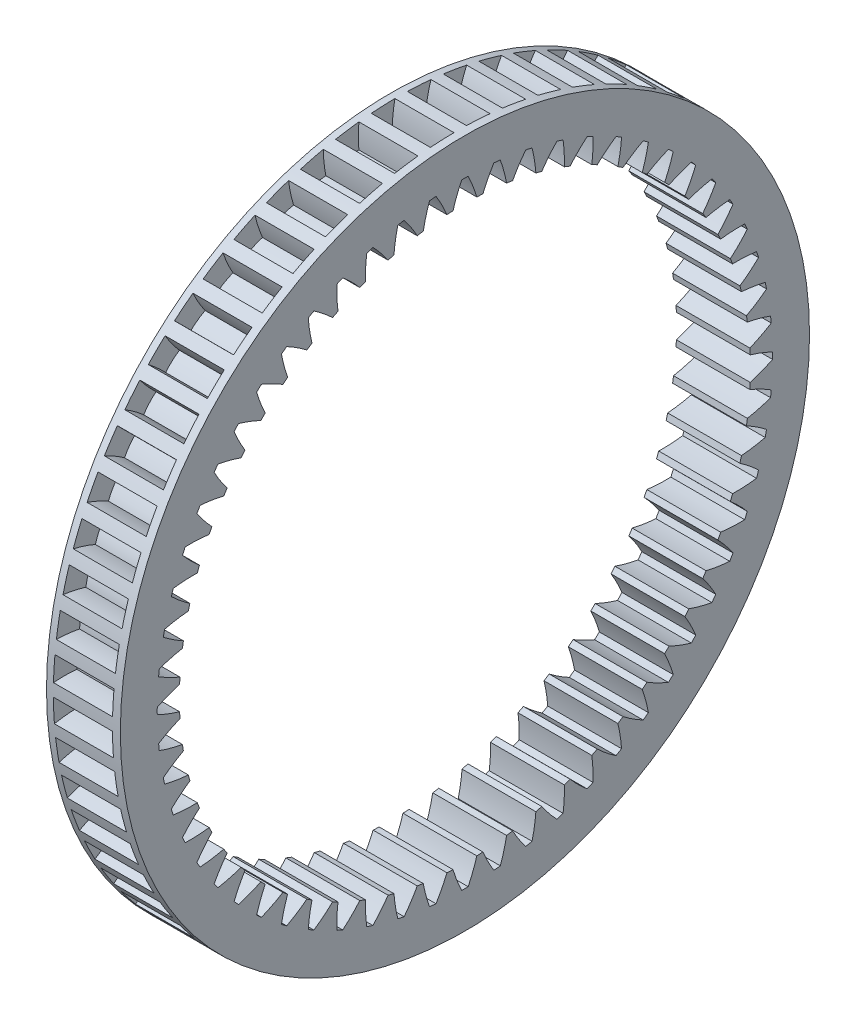
from build123d import *

# Parameters (mm, degrees)
SKETCH1_W           = 1.599635858
SKETCH1_H           = 70
BOSS_EXTRUDE1_DEPTH = 12
SKETCH3_R           = 70
BOSS_EXTRUDE2_DEPTH = 1.400364142
CUT_EXTRUDE1_DEPTH  = 138.402329374


with BuildPart() as part:
    # Sketch1 → Revolve1 (revolve)
    with BuildSketch(Plane(origin=(0, 0, -17.780283278), x_dir=(-1, 0, 0), z_dir=(0, 0, -1)), mode=Mode.PRIVATE) as revolve1_sk:
        with Locations((4.200182071, 69.637574442)):
            Rectangle(SKETCH1_W, SKETCH1_H)
    revolve(revolve1_sk.sketch.rotate(Axis((-3.400364142, 34.637574442, -17.780283278), (-1, 0, 0)), 270), axis=Axis((-3.400364142, 34.637574442, -17.780283278), (-1, 0, 0)))

    # Sketch2 → Boss-Extrude1 (add)
    with BuildSketch(Plane.ZY.offset(5)):
        with BuildLine():
            ThreePointArc((-82.867556768, 39.566803131), (-83.007438278, 37.673059904), (-82.867556768, 35.779316676))
            ThreePointArc((-82.867556768, 35.779316676), (-85.335284127, 35.638618783), (-87.777533963, 35.257974656))
            ThreePointArc((-87.777533963, 35.257974656), (-87.777284922, 33.989684921), (-87.754057451, 32.721607874))
            ThreePointArc((-87.754057451, 32.721607874), (-85.389808184, 32.618534204), (-83.026246573, 32.736327625))
            ThreePointArc((-83.026246573, 32.736327625), (-82.967411728, 30.838336921), (-82.630346435, 28.969589416))
            ThreePointArc((-82.630346435, 28.969589416), (-85.06984839, 28.571714532), (-87.458931181, 27.937870991))
            ThreePointArc((-87.458931181, 27.937870991), (-87.326111127, 26.676555113), (-87.170460754, 25.417852656))
            ThreePointArc((-87.170460754, 25.417852656), (-84.808388959, 25.562474977), (-82.470087952, 25.926682576))
            ThreePointArc((-82.470087952, 25.926682576), (-82.213181358, 24.04523918), (-81.682625239, 22.221961787))
            ThreePointArc((-81.682625239, 22.221961787), (-84.067174097, 21.571269112), (-86.376914551, 20.69117068))
            ThreePointArc((-86.376914551, 20.69117068), (-86.112978689, 19.450647898), (-85.826610751, 18.215110639))
            ThreePointArc((-85.826610751, 18.215110639), (-83.492595782, 18.605844439), (-81.205174293, 19.212475881))
            ThreePointArc((-81.205174293, 19.212475881), (-80.753010674, 17.368193281), (-80.034776612, 15.610362208))
            ThreePointArc((-80.034776612, 15.610362208), (-82.338246757, 14.713980868), (-84.543338875, 13.597270086))
            ThreePointArc((-84.543338875, 13.597270086), (-84.15117894, 12.391131828), (-83.737230945, 11.192296573))
            ThreePointArc((-83.737230945, 11.192296573), (-81.456844758, 11.824860889), (-79.245364255, 12.667269795))
            ThreePointArc((-79.245364255, 12.667269795), (-78.60289761, 10.880354335), (-77.704854729, 9.207228747))
            ThreePointArc((-77.704854729, 9.207228747), (-79.902008859, 8.074979684), (-81.97829319, 6.733891471))
            ThreePointArc((-81.97829319, 6.733891471), (-81.46220577, 5.575352439), (-80.925213018, 4.426353876))
            ThreePointArc((-80.925213018, 4.426353876), (-78.723440001, 5.293818204), (-76.612129928, 6.362774963))
            ThreePointArc((-76.612129928, 6.362774963), (-75.786399255, 4.652804465), (-74.7183867, 3.082715476))
            ThreePointArc((-74.7183867, 3.082715476), (-76.785152336, 1.727003847), (-78.709880674, 0.176231445))
            ThreePointArc((-78.709880674, 0.176231445), (-78.07552013, -0.922015164), (-77.421366027, -2.008588365))
            ThreePointArc((-77.421366027, -2.008588365), (-75.322329266, -0.915728148), (-73.334321578, 0.368064751))
            ThreePointArc((-73.334321578, 0.368064751), (-72.334373755, -1.246225991), (-71.108092896, -2.696076157))
            ThreePointArc((-71.108092896, -2.696076157), (-73.02182612, -4.260396892), (-74.773910738, -6.003862896))
            ThreePointArc((-74.773910738, -6.003862896), (-74.028227258, -7.029784462), (-73.264078853, -8.042027578))
            ThreePointArc((-73.264078853, -8.042027578), (-71.290775833, -6.735745077), (-69.447851558, -5.251181541))
            ThreePointArc((-69.447851558, -5.251181541), (-68.284642224, -6.752106021), (-66.91352845, -8.065832502))
            ThreePointArc((-66.91352845, -8.065832502), (-68.653262001, -9.821623317), (-70.213506694, -11.738681144))
            ThreePointArc((-70.213506694, -11.738681144), (-69.364670141, -12.681037456), (-68.498899603, -13.607860141))
            ThreePointArc((-68.498899603, -13.607860141), (-66.672950247, -12.10246726), (-64.995300849, -10.433398275))
            ThreePointArc((-64.995300849, -10.433398275), (-63.681574368, -11.804512049), (-62.180649888, -12.967721383))
            ThreePointArc((-62.180649888, -12.967721383), (-63.727322881, -14.895745468), (-65.078633281, -16.965391432))
            ThreePointArc((-65.078633281, -16.965391432), (-64.135943687, -17.813857837), (-63.178036579, -18.645105626))
            ThreePointArc((-63.178036579, -18.645105626), (-61.519446369, -16.957095764), (-60.025452526, -15.121808))
            ThreePointArc((-60.025452526, -15.121808), (-58.575602361, -16.34808886), (-56.961311618, -17.348036682))
            ThreePointArc((-56.961311618, -17.348036682), (-58.297978379, -19.4271702), (-59.425549248, -21.626728826))
            ThreePointArc((-59.425549248, -21.626728826), (-58.399334916, -22.372009349), (-57.359786271, -23.098574918))
            ThreePointArc((-57.359786271, -23.098574918), (-55.886727068, -21.246442265), (-54.592757289, -19.265043519))
            ThreePointArc((-54.592757289, -19.265043519), (-53.022668301, -20.333056074), (-51.312697802, -21.158786747))
            ThreePointArc((-51.312697802, -21.158786747), (-52.424713532, -23.366250276), (-53.316190966, -25.67162274))
            ThreePointArc((-53.316190966, -25.67162274), (-52.217695316, -26.305551931), (-51.107894644, -26.919474875))
            ThreePointArc((-51.107894644, -26.919474875), (-49.836505594, -24.923511784), (-48.756736883, -22.817710675))
            ThreePointArc((-48.756736883, -22.817710675), (-47.083611295, -23.715753557), (-45.296695836, -24.358220202))
            ThreePointArc((-45.296695836, -24.358220202), (-46.171877057, -26.66982831), (-46.817493844, -29.055756469))
            ThreePointArc((-46.817493844, -29.055756469), (-45.658752223, -29.571388868), (-44.490858734, -30.065942919))
            ThreePointArc((-44.490858734, -30.065942919), (-43.43506944, -27.948017579), (-42.581331969, -25.740885705))
            ThreePointArc((-42.581331969, -25.740885705), (-40.823500896, -26.459119766), (-38.979218296, -26.911283385))
            ThreePointArc((-38.979218296, -26.911283385), (-39.607976339, -29.301709611), (-40.000658965, -31.742052736))
            ThreePointArc((-40.000658965, -31.742052736), (-38.794366791, -32.133738965), (-37.581176169, -32.503505686))
            ThreePointArc((-37.581176169, -32.503505686), (-36.752554081, -30.28682253), (-36.134201576, -28.00254169))
            ThreePointArc((-36.134201576, -28.00254169), (-34.310924183, -28.533097809), (-32.429480787, -28.790004403))
            ThreePointArc((-32.429480787, -28.790004403), (-32.804926848, -31.233058735), (-32.940373001, -33.701079917))
            ThreePointArc((-32.940373001, -33.701079917), (-31.699746662, -33.964528581), (-30.454550878, -34.205456729))
            ThreePointArc((-30.454550878, -34.205456729), (-29.862174552, -31.914302202), (-29.485981813, -29.577899454))
            ThreePointArc((-29.485981813, -29.577899454), (-27.617234308, -29.914964748), (-25.719243605, -29.973799593))
            ThreePointArc((-25.719243605, -29.973799593), (-25.837264218, -32.442715418), (-25.713989921, -34.9113745))
            ThreePointArc((-25.713989921, -34.9113745), (-24.452621979, -35.043699199), (-23.189063659, -35.153149117))
            ThreePointArc((-23.189063659, -35.153149117), (-22.839423295, -32.812625587), (-22.709511967, -30.449699049))
            ThreePointArc((-22.709511967, -30.449699049), (-20.81576874, -30.589580558), (-18.922025512, -30.449699049))
            ThreePointArc((-18.922025512, -30.449699049), (-18.781327619, -32.917426408), (-18.400683492, -35.359676244))
            ThreePointArc((-18.400683492, -35.359676244), (-17.132393757, -35.359427202), (-15.86431671, -35.336199732))
            ThreePointArc((-15.86431671, -35.336199732), (-15.76124304, -32.971950465), (-15.879036461, -30.608388854))
            ThreePointArc((-15.879036461, -30.608388854), (-13.981045757, -30.549554009), (-12.112298252, -30.212488715))
            ThreePointArc((-12.112298252, -30.212488715), (-11.714423368, -32.651990671), (-11.080579827, -35.041073462))
            ThreePointArc((-11.080579827, -35.041073462), (-9.819263949, -34.908253408), (-8.560561492, -34.752603035))
            ThreePointArc((-8.560561492, -34.752603035), (-8.705183813, -32.39053124), (-9.069391412, -30.052230232))
            ThreePointArc((-9.069391412, -30.052230232), (-7.187948016, -29.795323639), (-5.364670623, -29.26476752))
            ThreePointArc((-5.364670623, -29.26476752), (-4.713977948, -31.649316378), (-3.833879516, -33.959056832))
            ThreePointArc((-3.833879516, -33.959056832), (-2.593356734, -33.695120969), (-1.357819475, -33.408753032))
            ThreePointArc((-1.357819475, -33.408753032), (-1.748553275, -31.074738063), (-2.355184717, -28.787316573))
            ThreePointArc((-2.355184717, -28.787316573), (-0.510902117, -28.335152954), (1.246928956, -27.616918893))
            ThreePointArc((1.246928956, -27.616918893), (2.143310296, -29.920389038), (3.260021078, -32.125481155))
            ThreePointArc((3.260021078, -32.125481155), (4.466159336, -31.733321221), (5.664994591, -31.319373226))
            ThreePointArc((5.664994591, -31.319373226), (5.032430275, -29.038987039), (4.190021369, -26.827506536))
            ThreePointArc((4.190021369, -26.827506536), (5.976936829, -26.18503989), (7.650062417, -25.286997009))
            ThreePointArc((7.650062417, -25.286997009), (8.78231148, -27.48415114), (10.123399693, -29.56043547))
            ThreePointArc((10.123399693, -29.56043547), (11.281938725, -29.04434805), (12.430937288, -28.507355299))
            ThreePointArc((12.430937288, -28.507355299), (11.563472961, -26.305582282), (10.494516201, -24.194272209))
            ThreePointArc((10.494516201, -24.194272209), (12.204486699, -23.368541536), (13.774575688, -22.300528981))
            ThreePointArc((13.774575688, -22.300528981), (15.130287317, -24.367294617), (16.681059719, -26.292022954))
            ThreePointArc((16.681059719, -26.292022954), (17.779306328, -25.657662411), (18.865879529, -25.003508308))
            ThreePointArc((18.865879529, -25.003508308), (17.773019313, -22.904471547), (16.489226413, -20.916463859))
            ThreePointArc((16.489226413, -20.916463859), (18.103517155, -19.916516036), (19.553367321, -18.690235177))
            ThreePointArc((19.553367321, -18.690235177), (21.117688056, -20.603968401), (22.86115406, -22.356053019))
            ThreePointArc((22.86115406, -22.356053019), (23.887075626, -21.610369539), (24.899318743, -20.846221133))
            ThreePointArc((24.899318743, -20.846221133), (23.593036241, -18.872918114), (22.108472705, -17.029993839))
            ThreePointArc((22.108472705, -17.029993839), (23.609397185, -15.866784505), (24.923123666, -14.495670731))
            ThreePointArc((24.923123666, -14.495670731), (26.678914481, -16.235404281), (28.595972308, -17.795648975))
            ThreePointArc((28.595972308, -17.795648975), (29.53832862, -16.946812422), (30.465151305, -16.081041884))
            ThreePointArc((30.465151305, -16.081041884), (28.959758424, -14.255092527), (27.290689439, -12.57744313))
            ThreePointArc((27.290689439, -12.57744313), (28.661803213, -11.263716648), (29.825012547, -9.762792169))
            ThreePointArc((29.825012547, -9.762792169), (31.753036632, -11.309465161), (33.822682596, -12.660775562))
            ThreePointArc((33.822682596, -12.660775562), (34.671149001, -11.718085967), (35.50239679, -10.76017886))
            ThreePointArc((35.50239679, -10.76017886), (33.814386928, -9.10158865), (31.979099164, -7.607594807))
            ThreePointArc((31.979099164, -7.607594807), (33.205380024, -6.157744641), (34.205327846, -4.543453899))
            ThreePointArc((34.205327846, -4.543453899), (36.284461364, -5.88012066), (38.48401999, -7.007691529))
            ThreePointArc((38.48401999, -7.007691529), (39.229300513, -5.981477197), (39.955866082, -4.941928551))
            ThreePointArc((39.955866082, -4.941928551), (38.103733429, -3.468869349), (36.122334683, -2.17489957))
            ThreePointArc((36.122334683, -2.17489957), (37.190347238, -0.604810581), (38.016077911, 1.105159917))
            ThreePointArc((38.016077911, 1.105159917), (40.22354144, -0.006855813), (42.528913904, -0.898333247))
            ThreePointArc((42.528913904, -0.898333247), (43.162843095, 0.200162403), (43.776766039, 1.309963075))
            ThreePointArc((43.776766039, 1.309963075), (41.780802948, 2.581352125), (39.675001839, 3.661120836))
            ThreePointArc((39.675001839, 3.661120836), (40.573044721, 5.334246424), (41.215511366, 7.121161883))
            ThreePointArc((41.215511366, 7.121161883), (43.527119474, 6.245980663), (45.913047633, 5.600363876))
            ThreePointArc((45.913047633, 5.600363876), (46.428680032, 6.759105496), (46.923234083, 7.926998985))
            ThreePointArc((46.923234083, 7.926998985), (44.805308743, 8.982788279), (42.598176869, 9.83652575))
            ThreePointArc((42.598176869, 9.83652575), (43.31641093, 11.594356823), (43.76857455, 13.438639424))
            ThreePointArc((43.76857455, 13.438639424), (46.159000775, 12.809881381), (48.5993439, 12.417198754))
            ThreePointArc((48.5993439, 12.417198754), (48.991030129, 13.623490928), (49.36079685, 14.83668155))
            ThreePointArc((49.36079685, 14.83668155), (47.144113694, 15.665303638), (44.859832854, 16.283656143))
            ThreePointArc((44.859832854, 16.283656143), (45.390388973, 18.106933537), (45.647295567, 19.988376932))
            ThreePointArc((45.647295567, 19.988376932), (48.090349899, 19.612930871), (50.558371081, 19.477484718))
            ThreePointArc((50.558371081, 19.477484718), (50.821819745, 20.718111058), (51.062747893, 21.963306841))
            ThreePointArc((51.062747893, 21.963306841), (48.771593366, 22.555683167), (46.435190618, 22.931875906))
            ThreePointArc((46.435190618, 22.931875906), (46.772255912, 24.800623411), (46.831090757, 26.698614115))
            ThreePointArc((46.831090757, 26.698614115), (49.300006582, 26.580593501), (51.768665664, 26.703867798))
            ThreePointArc((51.768665664, 26.703867798), (51.900990364, 27.96523574), (52.010440281, 29.22879406))
            ThreePointArc((52.010440281, 29.22879406), (49.669916751, 29.578434425), (47.306990213, 29.708345752))
            ThreePointArc((47.306990213, 29.708345752), (47.446871722, 31.60208898), (47.306990213, 33.495832207))
            ThreePointArc((47.306990213, 33.495832207), (49.774717572, 33.636530101), (52.216967408, 34.017174228))
            ThreePointArc((52.216967408, 34.017174228), (52.216718367, 35.285463962), (52.193490896, 36.553541009))
            ThreePointArc((52.193490896, 36.553541009), (49.829241629, 36.656614679), (47.465680018, 36.538821259))
            ThreePointArc((47.465680018, 36.538821259), (47.406845173, 38.436811962), (47.069779879, 40.305559467))
            ThreePointArc((47.069779879, 40.305559467), (49.509281835, 40.703434351), (51.898364626, 41.337277892))
            ThreePointArc((51.898364626, 41.337277892), (51.765544572, 42.598593771), (51.609894199, 43.857296227))
            ThreePointArc((51.609894199, 43.857296227), (49.247822404, 43.712673906), (46.909521396, 43.348466307))
            ThreePointArc((46.909521396, 43.348466307), (46.652614803, 45.229909703), (46.122058684, 47.053187097))
            ThreePointArc((46.122058684, 47.053187097), (48.506607542, 47.703879771), (50.816347996, 48.583978203))
            ThreePointArc((50.816347996, 48.583978203), (50.552412134, 49.824500986), (50.266044196, 51.060038244))
            ThreePointArc((50.266044196, 51.060038244), (47.932029227, 50.669304444), (45.644607737, 50.062673002))
            ThreePointArc((45.644607737, 50.062673002), (45.192444118, 51.906955603), (44.474210057, 53.664786676))
            ThreePointArc((44.474210057, 53.664786676), (46.777680202, 54.561168015), (48.982772319, 55.677878797))
            ThreePointArc((48.982772319, 55.677878797), (48.590612385, 56.884017055), (48.17666439, 58.082852311))
            ThreePointArc((48.17666439, 58.082852311), (45.896278203, 57.450287994), (43.6847977, 56.607879089))
            ThreePointArc((43.6847977, 56.607879089), (43.042331054, 58.394794548), (42.144288173, 60.067920136))
            ThreePointArc((42.144288173, 60.067920136), (44.341442304, 61.200169199), (46.417726634, 62.541257413))
            ThreePointArc((46.417726634, 62.541257413), (45.901639214, 63.699796444), (45.364646463, 64.848795007))
            ThreePointArc((45.364646463, 64.848795007), (43.162873446, 63.98133068), (41.051563373, 62.91237392))
            ThreePointArc((41.051563373, 62.91237392), (40.2258327, 64.622344419), (39.157820145, 66.192433407))
            ThreePointArc((39.157820145, 66.192433407), (41.224585781, 67.548145037), (43.149314118, 69.098917439))
            ThreePointArc((43.149314118, 69.098917439), (42.514953575, 70.197164047), (41.860799472, 71.283737249))
            ThreePointArc((41.860799472, 71.283737249), (39.761762711, 70.190877032), (37.773755023, 68.907084132))
            ThreePointArc((37.773755023, 68.907084132), (36.7738072, 70.521374875), (35.547526341, 71.97122504))
            ThreePointArc((35.547526341, 71.97122504), (37.461259565, 73.535545775), (39.213344183, 75.279011779))
            ThreePointArc((39.213344183, 75.279011779), (38.467660703, 76.304933345), (37.703512297, 77.317176462))
            ThreePointArc((37.703512297, 77.317176462), (35.730209278, 76.010893961), (33.887285003, 74.526330424))
            ThreePointArc((33.887285003, 74.526330424), (32.724075669, 76.027254904), (31.352961895, 77.340981385))
            ThreePointArc((31.352961895, 77.340981385), (33.092695446, 79.0967722), (34.652940139, 81.013830028))
            ThreePointArc((34.652940139, 81.013830028), (33.804103586, 81.95618634), (32.938333048, 82.883009024))
            ThreePointArc((32.938333048, 82.883009024), (31.112383692, 81.377616143), (29.434734294, 79.708547158))
            ThreePointArc((29.434734294, 79.708547158), (28.121007813, 81.079660933), (26.620083333, 82.242870267))
            ThreePointArc((26.620083333, 82.242870267), (28.166756325, 84.170894351), (29.518066726, 86.240540315))
            ThreePointArc((29.518066726, 86.240540315), (28.575377131, 87.08900672), (27.617470024, 87.920254509))
            ThreePointArc((27.617470024, 87.920254509), (25.958879814, 86.232244647), (24.464885971, 84.396956884))
            ThreePointArc((24.464885971, 84.396956884), (23.015035805, 85.623237743), (21.400745063, 86.623185565))
            ThreePointArc((21.400745063, 86.623185565), (22.737411824, 88.702319083), (23.864982693, 90.90187771))
            ThreePointArc((23.864982693, 90.90187771), (22.838768361, 91.647158232), (21.799219715, 92.373723801))
            ThreePointArc((21.799219715, 92.373723801), (20.326160513, 90.521591148), (19.032190734, 88.540192402))
            ThreePointArc((19.032190734, 88.540192402), (17.462101745, 89.608204957), (15.752131247, 90.43393563))
            ThreePointArc((15.752131247, 90.43393563), (16.864146977, 92.641399159), (17.755624411, 94.946771624))
            ThreePointArc((17.755624411, 94.946771624), (16.657128761, 95.580700814), (15.547328089, 96.194623758))
            ThreePointArc((15.547328089, 96.194623758), (14.275939039, 94.198660667), (13.196170328, 92.092859559))
            ThreePointArc((13.196170328, 92.092859559), (11.52304474, 92.99090244), (9.736129281, 93.633369085))
            ThreePointArc((9.736129281, 93.633369085), (10.611310501, 95.944977194), (11.256927288, 98.330905353))
            ThreePointArc((11.256927288, 98.330905353), (10.098185668, 98.846537751), (8.930292179, 99.341091802))
            ThreePointArc((8.930292179, 99.341091802), (7.874502885, 97.223166462), (7.020765414, 95.016034588))
            ThreePointArc((7.020765414, 95.016034588), (5.262934341, 95.73426865), (3.41865174, 96.186432269))
            ThreePointArc((3.41865174, 96.186432269), (4.047409783, 98.576858494), (4.44009241, 101.01720162))
            ThreePointArc((4.44009241, 101.01720162), (3.233800236, 101.408887849), (2.020609614, 101.778654569))
            ThreePointArc((2.020609614, 101.778654569), (1.191987526, 99.561971413), (0.573635021, 97.277690573))
            ThreePointArc((0.573635021, 97.277690573), (-1.249642373, 97.808246693), (-3.131085768, 98.065153286))
            ThreePointArc((-3.131085768, 98.065153286), (-2.755639707, 100.508207618), (-2.620193554, 102.9762288))
            ThreePointArc((-2.620193554, 102.9762288), (-3.860819893, 103.239677464), (-5.106015677, 103.480605613))
            ThreePointArc((-5.106015677, 103.480605613), (-5.698392003, 101.189451085), (-6.074584742, 98.853048337))
            ThreePointArc((-6.074584742, 98.853048337), (-7.943332247, 99.190113631), (-9.84132295, 99.248948476))
            ThreePointArc((-9.84132295, 99.248948476), (-9.723302337, 101.717864301), (-9.846576634, 104.186523383))
            ThreePointArc((-9.846576634, 104.186523383), (-11.107944576, 104.318848083), (-12.371502896, 104.428298))
            ThreePointArc((-12.371502896, 104.428298), (-12.721143261, 102.08777447), (-12.851054588, 99.724847932))
            ThreePointArc((-12.851054588, 99.724847932), (-14.744797816, 99.864729442), (-16.638541043, 99.724847932))
            ThreePointArc((-16.638541043, 99.724847932), (-16.779238937, 102.192575291), (-17.159883064, 104.634825127))
            ThreePointArc((-17.159883064, 104.634825127), (-18.428172798, 104.634576086), (-19.696249845, 104.611348615))
            ThreePointArc((-19.696249845, 104.611348615), (-19.799323515, 102.247099348), (-19.681530094, 99.883537738))
            ThreePointArc((-19.681530094, 99.883537738), (-21.579520798, 99.824702892), (-23.448268303, 99.487637599))
            ThreePointArc((-23.448268303, 99.487637599), (-23.846143187, 101.927139554), (-24.479986728, 104.316222345))
            ThreePointArc((-24.479986728, 104.316222345), (-25.741302607, 104.183402291), (-27.000005063, 104.027751918))
            ThreePointArc((-27.000005063, 104.027751918), (-26.855382742, 101.665680124), (-26.491175143, 99.327379116))
            ThreePointArc((-26.491175143, 99.327379116), (-28.372618539, 99.070472522), (-30.195895932, 98.539916403))
            ThreePointArc((-30.195895932, 98.539916403), (-30.846588607, 100.924465261), (-31.726687039, 103.234205715))
            ThreePointArc((-31.726687039, 103.234205715), (-32.967209821, 102.970269853), (-34.20274708, 102.683901915))
            ThreePointArc((-34.20274708, 102.683901915), (-33.81201328, 100.349886946), (-33.205381838, 98.062465457))
            ThreePointArc((-33.205381838, 98.062465457), (-35.049664438, 97.610301838), (-36.807495512, 96.892067776))
            ThreePointArc((-36.807495512, 96.892067776), (-37.703876851, 99.195537921), (-38.820587633, 101.400630039))
            ThreePointArc((-38.820587633, 101.400630039), (-40.026725891, 101.008470104), (-41.225561147, 100.594522109))
            ThreePointArc((-41.225561147, 100.594522109), (-40.59299683, 98.314135922), (-39.750587925, 96.102655419))
            ThreePointArc((-39.750587925, 96.102655419), (-41.537503384, 95.460188774), (-43.210628972, 94.562145893))
            ThreePointArc((-43.210628972, 94.562145893), (-44.342878035, 96.759300023), (-45.683966249, 98.835584354))
            ThreePointArc((-45.683966249, 98.835584354), (-46.84250528, 98.319496934), (-47.991503843, 97.782504182))
            ThreePointArc((-47.991503843, 97.782504182), (-47.124039516, 95.580731165), (-46.055082756, 93.469421092))
            ThreePointArc((-46.055082756, 93.469421092), (-47.765053255, 92.643690419), (-49.335142243, 91.575677864))
            ThreePointArc((-49.335142243, 91.575677864), (-50.690853873, 93.6424435), (-52.241626275, 95.567171838))
            ThreePointArc((-52.241626275, 95.567171838), (-53.339872883, 94.932811294), (-54.426446085, 94.278657191))
            ThreePointArc((-54.426446085, 94.278657191), (-53.333585868, 92.17962043), (-52.049792968, 90.191612742))
            ThreePointArc((-52.049792968, 90.191612742), (-53.664083711, 89.191664919), (-55.113933876, 87.96538406))
            ThreePointArc((-55.113933876, 87.96538406), (-56.678254611, 89.879117284), (-58.421720615, 91.631201902))
            ThreePointArc((-58.421720615, 91.631201902), (-59.447642181, 90.885518422), (-60.459885298, 90.121370017))
            ThreePointArc((-60.459885298, 90.121370017), (-59.153602797, 88.148066997), (-57.66903926, 86.305142722))
            ThreePointArc((-57.66903926, 86.305142722), (-59.16996374, 85.141933388), (-60.483690221, 83.770819614))
            ThreePointArc((-60.483690221, 83.770819614), (-62.239481036, 85.510553165), (-64.156538864, 87.070797858))
            ThreePointArc((-64.156538864, 87.070797858), (-65.098895176, 86.221961305), (-66.02571786, 85.356190767))
            ThreePointArc((-66.02571786, 85.356190767), (-64.520324979, 83.530241411), (-62.851255994, 81.852592013))
            ThreePointArc((-62.851255994, 81.852592013), (-64.222369769, 80.538865532), (-65.385579103, 79.037941052))
            ThreePointArc((-65.385579103, 79.037941052), (-67.313603187, 80.584614045), (-69.383249151, 81.935924445))
            ThreePointArc((-69.383249151, 81.935924445), (-70.231715556, 80.993234851), (-71.062963345, 80.035327743))
            ThreePointArc((-71.062963345, 80.035327743), (-69.374953483, 78.376737533), (-67.53966572, 76.88274369))
            ThreePointArc((-67.53966572, 76.88274369), (-68.765946579, 75.432893525), (-69.765894401, 73.818602782))
            ThreePointArc((-69.765894401, 73.818602782), (-71.845027919, 75.155269543), (-74.044586546, 76.282840412))
            ThreePointArc((-74.044586546, 76.282840412), (-74.789867068, 75.25662608), (-75.516432637, 74.217077435))
            ThreePointArc((-75.516432637, 74.217077435), (-73.664299984, 72.744018232), (-71.682901238, 71.450048453))
            ThreePointArc((-71.682901238, 71.450048453), (-72.750913793, 69.879959465), (-73.576644466, 68.169988966))
            ThreePointArc((-73.576644466, 68.169988966), (-75.784107995, 69.282004696), (-78.08948046, 70.17348213))
            ThreePointArc((-78.08948046, 70.17348213), (-78.72340965, 69.07498648), (-79.337332594, 67.965185808))
            ThreePointArc((-79.337332594, 67.965185808), (-77.341369503, 66.693796758), (-75.235568395, 65.614028047))
            ThreePointArc((-75.235568395, 65.614028047), (-76.133611276, 63.940902459), (-76.776077921, 62.153987))
            ThreePointArc((-76.776077921, 62.153987), (-79.08768603, 63.029168221), (-81.473614189, 63.674785008))
            ThreePointArc((-81.473614189, 63.674785008), (-81.989246587, 62.516043387), (-82.483800638, 61.348149898))
            ThreePointArc((-82.483800638, 61.348149898), (-80.365875298, 60.292360605), (-78.158743424, 59.438623133))
            ThreePointArc((-78.158743424, 59.438623133), (-78.876977486, 57.68079206), (-79.329141105, 55.83650946))
            ThreePointArc((-79.329141105, 55.83650946), (-81.71956733, 56.465267503), (-84.159910456, 56.857950129))
            ThreePointArc((-84.159910456, 56.857950129), (-84.551596685, 55.651657955), (-84.921363405, 54.438467333))
            ThreePointArc((-84.921363405, 54.438467333), (-82.704680249, 53.609845245), (-80.420399409, 52.99149274))
            ThreePointArc((-80.420399409, 52.99149274), (-80.950955529, 51.168215347), (-81.207862122, 49.286771951))
            ThreePointArc((-81.207862122, 49.286771951), (-83.650916454, 49.662218012), (-86.118937636, 49.797664165))
            ThreePointArc((-86.118937636, 49.797664165), (-86.3823863, 48.557037826), (-86.623314448, 47.311842042))
            ThreePointArc((-86.623314448, 47.311842042), (-84.332159921, 46.719465716), (-81.995757173, 46.343272977))
            ThreePointArc((-81.995757173, 46.343272977), (-82.332822467, 44.474525472), (-82.391657312, 42.576534769))
            ThreePointArc((-82.391657312, 42.576534769), (-84.860573137, 42.694555382), (-87.329232219, 42.571281086))
            ThreePointArc((-87.329232219, 42.571281086), (-87.461556919, 41.309913143), (-87.571006836, 40.046354823))
            ThreePointArc((-87.571006836, 40.046354823), (-85.230483306, 39.696714459), (-82.867556768, 39.566803131))
        make_face()
    extrude(amount=BOSS_EXTRUDE1_DEPTH)

    # Sketch3 → Boss-Extrude2 (add)
    with BuildSketch(Plane.ZY.offset(17)):
        with Locations((-17.780283278, 34.637574442)):
            Circle(SKETCH3_R)
    extrude(amount=BOSS_EXTRUDE2_DEPTH)

    # Sketch4 → Cut-Extrude1 (cut, through all)
    with BuildSketch(Plane.ZY.offset(18.400364142)):
        with BuildLine():
            ThreePointArc((-23.659576439, 96.861435724), (-24.31341676, 96.796187424), (-24.966534987, 96.724068846))
            ThreePointArc((-24.966534987, 96.724068846), (-25.699822782, 94.396523797), (-26.241509142, 92.017079989))
            ThreePointArc((-26.241509142, 92.017079989), (-26.85348225, 91.923498196), (-27.464421627, 91.82338968))
            ThreePointArc((-27.464421627, 91.82338968), (-28.714884542, 93.918984927), (-30.131533654, 95.906013422))
            ThreePointArc((-30.131533654, 95.906013422), (-30.774971865, 95.772777635), (-31.416973798, 95.632784685))
            ThreePointArc((-31.416973798, 95.632784685), (-31.902949859, 93.241340725), (-32.192949199, 90.818310117))
            ThreePointArc((-32.192949199, 90.818310117), (-32.791787894, 90.661272366), (-33.388916291, 90.497851701))
            ThreePointArc((-33.388916291, 90.497851701), (-34.851578391, 92.451258091), (-36.468167986, 94.279321282))
            ThreePointArc((-36.468167986, 94.279321282), (-37.094154443, 94.079557767), (-37.718006174, 93.873224237))
            ThreePointArc((-37.718006174, 93.873224237), (-37.951346045, 91.444082527), (-37.986481072, 89.004012348))
            ThreePointArc((-37.986481072, 89.004012348), (-38.565624351, 88.785239178), (-39.142399506, 88.560296834))
            ThreePointArc((-39.142399506, 88.560296834), (-40.801235558, 90.350112439), (-42.600053942, 91.999181682))
            ThreePointArc((-42.600053942, 91.999181682), (-43.201730206, 91.73507909), (-43.800596685, 91.464665615))
            ThreePointArc((-43.800596685, 91.464665615), (-43.778743846, 89.024440338), (-43.558629614, 86.594064509))
            ThreePointArc((-43.558629614, 86.594064509), (-44.111732262, 86.315952845), (-44.661834905, 86.031953338))
            ThreePointArc((-44.661834905, 86.031953338), (-46.498670354, 87.638568562), (-48.460009296, 89.090576309))
            ThreePointArc((-48.460009296, 89.090576309), (-49.030783278, 88.765028204), (-49.598103198, 88.433497489))
            ThreePointArc((-49.598103198, 88.433497489), (-49.321297073, 86.008924266), (-48.848345199, 83.614870492))
            ThreePointArc((-48.848345199, 83.614870492), (-49.369347308, 83.280467382), (-49.886750399, 82.940522271))
            ThreePointArc((-49.886750399, 82.940522271), (-51.881460492, 84.346334702), (-53.983831153, 85.585372454))
            ThreePointArc((-53.983831153, 85.585372454), (-54.517449331, 85.201945607), (-55.047007018, 84.812929973))
            ThreePointArc((-55.047007018, 84.812929973), (-54.518280353, 82.430572934), (-53.797672597, 80.09907097))
            ThreePointArc((-53.797672597, 80.09907097), (-54.280865958, 79.712040206), (-54.759900721, 79.319873999))
            ThreePointArc((-54.759900721, 79.319873999), (-56.890630996, 80.509481262), (-59.110999362, 81.521973861))
            ThreePointArc((-59.110999362, 81.521973861), (-59.601615306, 81.084869179), (-60.087608813, 80.642630762))
            ThreePointArc((-60.087608813, 80.642630762), (-59.312754448, 78.32859151), (-58.352385939, 76.085185779))
            ThreePointArc((-58.352385939, 76.085185779), (-58.792476586, 75.64976775), (-59.227894615, 75.209677104))
            ThreePointArc((-59.227894615, 75.209677104), (-61.471300346, 76.170045612), (-63.785339598, 76.944899977))
            ThreePointArc((-63.785339598, 76.944899977), (-64.227578015, 76.45890647), (-64.664682697, 75.968290527))
            ThreePointArc((-64.664682697, 75.968290527), (-63.652190098, 73.74792216), (-62.462582835, 71.617191885))
            ThreePointArc((-62.462582835, 71.617191885), (-62.854749042, 71.138157123), (-63.241779806, 70.654963761))
            ThreePointArc((-63.241779806, 70.654963761), (-65.57328177, 71.375571517), (-67.955638809, 71.904298182))
            ThreePointArc((-67.955638809, 71.904298182), (-68.344654443, 71.374740495), (-68.728081289, 70.841122317))
            ThreePointArc((-68.728081289, 70.841122317), (-67.489043538, 68.738751656), (-66.083231107, 66.744041563))
            ThreePointArc((-66.083231107, 66.744041563), (-66.423176218, 66.226638473), (-66.757579328, 65.705636364))
            ThreePointArc((-66.757579328, 65.705636364), (-69.151633102, 66.178588237), (-71.576206325, 66.455394362))
            ThreePointArc((-71.576206325, 66.455394362), (-71.90773704, 65.888074442), (-72.233285145, 65.31730046))
            ThreePointArc((-72.233285145, 65.31730046), (-70.781277398, 63.355961518), (-69.174662174, 61.519126069))
            ThreePointArc((-69.174662174, 61.519126069), (-69.458661681, 60.969023427), (-69.736773345, 60.415920778))
            ThreePointArc((-69.736773345, 60.415920778), (-72.167149174, 60.63603501), (-74.60737445, 60.657887849))
            ThreePointArc((-74.60737445, 60.657887849), (-74.877787926, 60.059021371), (-75.141890518, 59.457345106))
            ThreePointArc((-75.141890518, 59.457345106), (-73.492821275, 57.658526722), (-71.70300567, 55.99969067))
            ThreePointArc((-71.70300567, 55.99969067), (-71.927948014, 55.422915515), (-72.146721184, 54.843772236))
            ThreePointArc((-72.146721184, 54.843772236), (-74.586791363, 54.808637209), (-77.015933073, 54.575297338))
            ThreePointArc((-77.015933073, 54.575297338), (-77.222266603, 53.951445607), (-77.422030118, 53.32545915))
            ThreePointArc((-77.422030118, 53.32545915), (-75.593966927, 51.708869555), (-73.640560537, 50.246207455))
            ThreePointArc((-73.640560537, 50.246207455), (-73.803981202, 49.649079058), (-73.961018953, 49.050240363))
            ThreePointArc((-73.961018953, 49.050240363), (-76.384049561, 48.760241023), (-78.775493521, 48.274264962))
            ThreePointArc((-78.775493521, 48.274264962), (-78.915486471, 47.632263029), (-79.048722258, 46.988824818))
            ThreePointArc((-79.048722258, 46.988824818), (-77.061693763, 45.572175706), (-74.966098516, 44.321712791))
            ThreePointArc((-74.966098516, 44.321712791), (-75.066207032, 43.710773414), (-75.159788825, 43.098800306))
            ThreePointArc((-75.159788825, 43.098800306), (-77.539232633, 42.557113946), (-79.866777682, 41.823826151))
            ThreePointArc((-79.866777682, 41.823826151), (-79.93889626, 41.170707924), (-80.00414456, 40.516867603))
            ThreePointArc((-80.00414456, 40.516867603), (-77.879921061, 39.315680078), (-75.665096736, 38.29111668))
            ThreePointArc((-75.665096736, 38.29111668), (-75.700796293, 37.673059904), (-75.729896827, 37.054657287))
            ThreePointArc((-75.729896827, 37.054657287), (-78.03968415, 36.267218738), (-80.277829217, 35.294653262))
            ThreePointArc((-80.277829217, 35.294653262), (-80.281283278, 34.637574442), (-80.277829217, 33.980495621))
            ThreePointArc((-80.277829217, 33.980495621), (-78.03968415, 33.007930146), (-75.729896827, 32.220491596))
            ThreePointArc((-75.729896827, 32.220491596), (-75.700796293, 31.60208898), (-75.665096736, 30.984032203))
            ThreePointArc((-75.665096736, 30.984032203), (-77.879921061, 29.959468805), (-80.00414456, 28.758281281))
            ThreePointArc((-80.00414456, 28.758281281), (-79.93889626, 28.104440959), (-79.866777682, 27.451322733))
            ThreePointArc((-79.866777682, 27.451322733), (-77.539232633, 26.718034937), (-75.159788825, 26.176348578))
            ThreePointArc((-75.159788825, 26.176348578), (-75.066207032, 25.564375469), (-74.966098516, 24.953436092))
            ThreePointArc((-74.966098516, 24.953436092), (-77.061693763, 23.702973177), (-79.048722258, 22.286324065))
            ThreePointArc((-79.048722258, 22.286324065), (-78.915486471, 21.642885854), (-78.775493521, 21.000883922))
            ThreePointArc((-78.775493521, 21.000883922), (-76.384049561, 20.51490786), (-73.961018953, 20.22490852))
            ThreePointArc((-73.961018953, 20.22490852), (-73.803981202, 19.626069826), (-73.640560537, 19.028941428))
            ThreePointArc((-73.640560537, 19.028941428), (-75.593966927, 17.566279328), (-77.422030118, 15.949689734))
            ThreePointArc((-77.422030118, 15.949689734), (-77.222266603, 15.323703276), (-77.015933073, 14.699851546))
            ThreePointArc((-77.015933073, 14.699851546), (-74.586791363, 14.466511674), (-72.146721184, 14.431376647))
            ThreePointArc((-72.146721184, 14.431376647), (-71.927948014, 13.852233368), (-71.70300567, 13.275458213))
            ThreePointArc((-71.70300567, 13.275458213), (-73.492821275, 11.616622161), (-75.141890518, 9.817803778))
            ThreePointArc((-75.141890518, 9.817803778), (-74.877787926, 9.216127513), (-74.60737445, 8.617261034))
            ThreePointArc((-74.60737445, 8.617261034), (-72.167149174, 8.639113873), (-69.736773345, 8.859228105))
            ThreePointArc((-69.736773345, 8.859228105), (-69.458661681, 8.306125457), (-69.174662174, 7.756022814))
            ThreePointArc((-69.174662174, 7.756022814), (-70.781277398, 5.919187365), (-72.233285145, 3.957848423))
            ThreePointArc((-72.233285145, 3.957848423), (-71.90773704, 3.387074442), (-71.576206325, 2.819754521))
            ThreePointArc((-71.576206325, 2.819754521), (-69.151633102, 3.096560646), (-66.757579328, 3.56951252))
            ThreePointArc((-66.757579328, 3.56951252), (-66.423176218, 3.048510411), (-66.083231107, 2.53110732))
            ThreePointArc((-66.083231107, 2.53110732), (-67.489043538, 0.536397227), (-68.728081289, -1.565973433))
            ThreePointArc((-68.728081289, -1.565973433), (-68.344654443, -2.099591612), (-67.955638809, -2.629149298))
            ThreePointArc((-67.955638809, -2.629149298), (-65.57328177, -2.100422633), (-63.241779806, -1.379814877))
            ThreePointArc((-63.241779806, -1.379814877), (-62.854749042, -1.863008239), (-62.462582835, -2.342043002))
            ThreePointArc((-62.462582835, -2.342043002), (-63.652190098, -4.472773277), (-64.664682697, -6.693141643))
            ThreePointArc((-64.664682697, -6.693141643), (-64.227578015, -7.183757586), (-63.785339598, -7.669751094))
            ThreePointArc((-63.785339598, -7.669751094), (-61.471300346, -6.894896729), (-59.227894615, -5.93452822))
            ThreePointArc((-59.227894615, -5.93452822), (-58.792476586, -6.374618867), (-58.352385939, -6.810036896))
            ThreePointArc((-58.352385939, -6.810036896), (-59.312754448, -9.053442627), (-60.087608813, -11.367481878))
            ThreePointArc((-60.087608813, -11.367481878), (-59.601615306, -11.809720296), (-59.110999362, -12.246824978))
            ThreePointArc((-59.110999362, -12.246824978), (-56.890630996, -11.234332379), (-54.759900721, -10.044725116))
            ThreePointArc((-54.759900721, -10.044725116), (-54.280865958, -10.436891323), (-53.797672597, -10.823922087))
            ThreePointArc((-53.797672597, -10.823922087), (-54.518280353, -13.155424051), (-55.047007018, -15.53778109))
            ThreePointArc((-55.047007018, -15.53778109), (-54.517449331, -15.926796724), (-53.983831153, -16.31022357))
            ThreePointArc((-53.983831153, -16.31022357), (-51.881460492, -15.071185818), (-49.886750399, -13.665373387))
            ThreePointArc((-49.886750399, -13.665373387), (-49.369347308, -14.005318499), (-48.848345199, -14.339721609))
            ThreePointArc((-48.848345199, -14.339721609), (-49.321297073, -16.733775382), (-49.598103198, -19.158348606))
            ThreePointArc((-49.598103198, -19.158348606), (-49.030783278, -19.48987932), (-48.460009296, -19.815427426))
            ThreePointArc((-48.460009296, -19.815427426), (-46.498670354, -18.363419678), (-44.661834905, -16.756804454))
            ThreePointArc((-44.661834905, -16.756804454), (-44.111732262, -17.040803961), (-43.558629614, -17.318915626))
            ThreePointArc((-43.558629614, -17.318915626), (-43.778743846, -19.749291455), (-43.800596685, -22.189516731))
            ThreePointArc((-43.800596685, -22.189516731), (-43.201730206, -22.459930206), (-42.600053942, -22.724032799))
            ThreePointArc((-42.600053942, -22.724032799), (-40.801235558, -21.074963556), (-39.142399506, -19.285147951))
            ThreePointArc((-39.142399506, -19.285147951), (-38.565624351, -19.510090295), (-37.986481072, -19.728863465))
            ThreePointArc((-37.986481072, -19.728863465), (-37.951346045, -22.168933644), (-37.718006174, -24.598075354))
            ThreePointArc((-37.718006174, -24.598075354), (-37.094154443, -24.804408883), (-36.468167986, -25.004172398))
            ThreePointArc((-36.468167986, -25.004172398), (-34.851578391, -23.176109208), (-33.388916291, -21.222702817))
            ThreePointArc((-33.388916291, -21.222702817), (-32.791787894, -21.386123483), (-32.192949199, -21.543161234))
            ThreePointArc((-32.192949199, -21.543161234), (-31.902949859, -23.966191842), (-31.416973798, -26.357635802))
            ThreePointArc((-31.416973798, -26.357635802), (-30.774971865, -26.497628752), (-30.131533654, -26.630864539))
            ThreePointArc((-30.131533654, -26.630864539), (-28.714884542, -24.643836044), (-27.464421627, -22.548240796))
            ThreePointArc((-27.464421627, -22.548240796), (-26.85348225, -22.648349313), (-26.241509142, -22.741931106))
            ThreePointArc((-26.241509142, -22.741931106), (-25.699822782, -25.121374914), (-24.966534987, -27.448919962))
            ThreePointArc((-24.966534987, -27.448919962), (-24.31341676, -27.521038541), (-23.659576439, -27.586286841))
            ThreePointArc((-23.659576439, -27.586286841), (-22.458388914, -25.462063341), (-21.433825516, -23.247239017))
            ThreePointArc((-21.433825516, -23.247239017), (-20.81576874, -23.282938574), (-20.197366123, -23.312039108))
            ThreePointArc((-20.197366123, -23.312039108), (-19.409927574, -25.62182643), (-18.437362098, -27.859971498))
            ThreePointArc((-18.437362098, -27.859971498), (-17.780283278, -27.863425558), (-17.123204457, -27.859971498))
            ThreePointArc((-17.123204457, -27.859971498), (-16.150638982, -25.62182643), (-15.363200432, -23.312039108))
            ThreePointArc((-15.363200432, -23.312039108), (-14.744797816, -23.282938574), (-14.126741039, -23.247239017))
            ThreePointArc((-14.126741039, -23.247239017), (-13.102177641, -25.462063341), (-11.900990117, -27.586286841))
            ThreePointArc((-11.900990117, -27.586286841), (-11.247149795, -27.521038541), (-10.594031569, -27.448919962))
            ThreePointArc((-10.594031569, -27.448919962), (-9.860743773, -25.121374914), (-9.319057414, -22.741931106))
            ThreePointArc((-9.319057414, -22.741931106), (-8.707084305, -22.648349313), (-8.096144928, -22.548240796))
            ThreePointArc((-8.096144928, -22.548240796), (-6.845682013, -24.643836044), (-5.429032901, -26.630864539))
            ThreePointArc((-5.429032901, -26.630864539), (-4.78559469, -26.497628752), (-4.143592758, -26.357635802))
            ThreePointArc((-4.143592758, -26.357635802), (-3.657616696, -23.966191842), (-3.367617356, -21.543161234))
            ThreePointArc((-3.367617356, -21.543161234), (-2.768778662, -21.386123483), (-2.171650264, -21.222702817))
            ThreePointArc((-2.171650264, -21.222702817), (-0.708988164, -23.176109208), (0.90760143, -25.004172398))
            ThreePointArc((0.90760143, -25.004172398), (1.533587888, -24.804408883), (2.157439618, -24.598075354))
            ThreePointArc((2.157439618, -24.598075354), (2.39077949, -22.168933644), (2.425914517, -19.728863465))
            ThreePointArc((2.425914517, -19.728863465), (3.005057796, -19.510090295), (3.581832951, -19.285147951))
            ThreePointArc((3.581832951, -19.285147951), (5.240669003, -21.074963556), (7.039487386, -22.724032799))
            ThreePointArc((7.039487386, -22.724032799), (7.641163651, -22.459930206), (8.24003013, -22.189516731))
            ThreePointArc((8.24003013, -22.189516731), (8.218177291, -19.749291455), (7.998063059, -17.318915626))
            ThreePointArc((7.998063059, -17.318915626), (8.551165707, -17.040803961), (9.10126835, -16.756804454))
            ThreePointArc((9.10126835, -16.756804454), (10.938103799, -18.363419678), (12.899442741, -19.815427426))
            ThreePointArc((12.899442741, -19.815427426), (13.470216722, -19.48987932), (14.037536643, -19.158348606))
            ThreePointArc((14.037536643, -19.158348606), (13.760730518, -16.733775382), (13.287778644, -14.339721609))
            ThreePointArc((13.287778644, -14.339721609), (13.808780753, -14.005318499), (14.326183844, -13.665373387))
            ThreePointArc((14.326183844, -13.665373387), (16.320893937, -15.071185818), (18.423264597, -16.31022357))
            ThreePointArc((18.423264597, -16.31022357), (18.956882776, -15.926796724), (19.486440462, -15.53778109))
            ThreePointArc((19.486440462, -15.53778109), (18.957713797, -13.155424051), (18.237106042, -10.823922087))
            ThreePointArc((18.237106042, -10.823922087), (18.720299403, -10.436891323), (19.199334166, -10.044725116))
            ThreePointArc((19.199334166, -10.044725116), (21.330064441, -11.234332379), (23.550432807, -12.246824978))
            ThreePointArc((23.550432807, -12.246824978), (24.04104875, -11.809720296), (24.527042258, -11.367481878))
            ThreePointArc((24.527042258, -11.367481878), (23.752187893, -9.053442627), (22.791819384, -6.810036896))
            ThreePointArc((22.791819384, -6.810036896), (23.231910031, -6.374618867), (23.66732806, -5.93452822))
            ThreePointArc((23.66732806, -5.93452822), (25.910733791, -6.894896729), (28.224773043, -7.669751094))
            ThreePointArc((28.224773043, -7.669751094), (28.66701146, -7.183757586), (29.104116142, -6.693141643))
            ThreePointArc((29.104116142, -6.693141643), (28.091623543, -4.472773277), (26.90201628, -2.342043002))
            ThreePointArc((26.90201628, -2.342043002), (27.294182487, -1.863008239), (27.681213251, -1.379814877))
            ThreePointArc((27.681213251, -1.379814877), (30.012715215, -2.100422633), (32.395072254, -2.629149298))
            ThreePointArc((32.395072254, -2.629149298), (32.784087888, -2.099591612), (33.167514734, -1.565973433))
            ThreePointArc((33.167514734, -1.565973433), (31.928476983, 0.536397227), (30.522664551, 2.53110732))
            ThreePointArc((30.522664551, 2.53110732), (30.862609663, 3.048510411), (31.197012773, 3.56951252))
            ThreePointArc((31.197012773, 3.56951252), (33.591066546, 3.096560646), (36.01563977, 2.819754521))
            ThreePointArc((36.01563977, 2.819754521), (36.347170484, 3.387074442), (36.67271859, 3.957848423))
            ThreePointArc((36.67271859, 3.957848423), (35.220710843, 5.919187365), (33.614095618, 7.756022814))
            ThreePointArc((33.614095618, 7.756022814), (33.898095125, 8.306125457), (34.17620679, 8.859228105))
            ThreePointArc((34.17620679, 8.859228105), (36.606582619, 8.639113873), (39.046807895, 8.617261034))
            ThreePointArc((39.046807895, 8.617261034), (39.317221371, 9.216127513), (39.581323963, 9.817803778))
            ThreePointArc((39.581323963, 9.817803778), (37.93225472, 11.616622161), (36.142439115, 13.275458213))
            ThreePointArc((36.142439115, 13.275458213), (36.367381459, 13.852233368), (36.586154629, 14.431376647))
            ThreePointArc((36.586154629, 14.431376647), (39.026224808, 14.466511674), (41.455366518, 14.699851546))
            ThreePointArc((41.455366518, 14.699851546), (41.661700047, 15.323703276), (41.861463563, 15.949689734))
            ThreePointArc((41.861463563, 15.949689734), (40.033400372, 17.566279328), (38.079993981, 19.028941428))
            ThreePointArc((38.079993981, 19.028941428), (38.243414647, 19.626069826), (38.400452398, 20.22490852))
            ThreePointArc((38.400452398, 20.22490852), (40.823483006, 20.51490786), (43.214926966, 21.000883922))
            ThreePointArc((43.214926966, 21.000883922), (43.354919916, 21.642885854), (43.488155703, 22.286324065))
            ThreePointArc((43.488155703, 22.286324065), (41.501127208, 23.702973177), (39.40553196, 24.953436092))
            ThreePointArc((39.40553196, 24.953436092), (39.505640477, 25.564375469), (39.59922227, 26.176348578))
            ThreePointArc((39.59922227, 26.176348578), (41.978666078, 26.718034937), (44.306211126, 27.451322733))
            ThreePointArc((44.306211126, 27.451322733), (44.378329705, 28.104440959), (44.443578005, 28.758281281))
            ThreePointArc((44.443578005, 28.758281281), (42.319354505, 29.959468805), (40.104530181, 30.984032203))
            ThreePointArc((40.104530181, 30.984032203), (40.140229738, 31.60208898), (40.169330272, 32.220491596))
            ThreePointArc((40.169330272, 32.220491596), (42.479117595, 33.007930146), (44.717262662, 33.980495621))
            ThreePointArc((44.717262662, 33.980495621), (44.720716722, 34.637574442), (44.717262662, 35.294653262))
            ThreePointArc((44.717262662, 35.294653262), (42.479117595, 36.267218738), (40.169330272, 37.054657287))
            ThreePointArc((40.169330272, 37.054657287), (40.140229738, 37.673059904), (40.104530181, 38.29111668))
            ThreePointArc((40.104530181, 38.29111668), (42.319354505, 39.315680078), (44.443578005, 40.516867603))
            ThreePointArc((44.443578005, 40.516867603), (44.378329705, 41.170707924), (44.306211126, 41.823826151))
            ThreePointArc((44.306211126, 41.823826151), (41.978666078, 42.557113946), (39.59922227, 43.098800306))
            ThreePointArc((39.59922227, 43.098800306), (39.505640477, 43.710773414), (39.40553196, 44.321712791))
            ThreePointArc((39.40553196, 44.321712791), (41.501127208, 45.572175706), (43.488155703, 46.988824818))
            ThreePointArc((43.488155703, 46.988824818), (43.354919916, 47.632263029), (43.214926966, 48.274264962))
            ThreePointArc((43.214926966, 48.274264962), (40.823483006, 48.760241023), (38.400452398, 49.050240363))
            ThreePointArc((38.400452398, 49.050240363), (38.243414647, 49.649079058), (38.079993981, 50.246207455))
            ThreePointArc((38.079993981, 50.246207455), (40.033400372, 51.708869555), (41.861463563, 53.32545915))
            ThreePointArc((41.861463563, 53.32545915), (41.661700047, 53.951445607), (41.455366518, 54.575297338))
            ThreePointArc((41.455366518, 54.575297338), (39.026224808, 54.808637209), (36.586154629, 54.843772236))
            ThreePointArc((36.586154629, 54.843772236), (36.367381459, 55.422915515), (36.142439115, 55.99969067))
            ThreePointArc((36.142439115, 55.99969067), (37.93225472, 57.658526722), (39.581323963, 59.457345106))
            ThreePointArc((39.581323963, 59.457345106), (39.317221371, 60.059021371), (39.046807895, 60.657887849))
            ThreePointArc((39.046807895, 60.657887849), (36.606582619, 60.63603501), (34.17620679, 60.415920778))
            ThreePointArc((34.17620679, 60.415920778), (33.898095125, 60.969023427), (33.614095618, 61.519126069))
            ThreePointArc((33.614095618, 61.519126069), (35.220710843, 63.355961518), (36.67271859, 65.31730046))
            ThreePointArc((36.67271859, 65.31730046), (36.347170484, 65.888074442), (36.01563977, 66.455394362))
            ThreePointArc((36.01563977, 66.455394362), (33.591066546, 66.178588237), (31.197012773, 65.705636364))
            ThreePointArc((31.197012773, 65.705636364), (30.862609663, 66.226638473), (30.522664551, 66.744041563))
            ThreePointArc((30.522664551, 66.744041563), (31.928476983, 68.738751656), (33.167514734, 70.841122317))
            ThreePointArc((33.167514734, 70.841122317), (32.784087888, 71.374740495), (32.395072254, 71.904298182))
            ThreePointArc((32.395072254, 71.904298182), (30.012715215, 71.375571517), (27.681213251, 70.654963761))
            ThreePointArc((27.681213251, 70.654963761), (27.294182487, 71.138157123), (26.90201628, 71.617191885))
            ThreePointArc((26.90201628, 71.617191885), (28.091623543, 73.74792216), (29.104116142, 75.968290527))
            ThreePointArc((29.104116142, 75.968290527), (28.66701146, 76.45890647), (28.224773043, 76.944899977))
            ThreePointArc((28.224773043, 76.944899977), (25.910733791, 76.170045612), (23.66732806, 75.209677104))
            ThreePointArc((23.66732806, 75.209677104), (23.231910031, 75.64976775), (22.791819384, 76.085185779))
            ThreePointArc((22.791819384, 76.085185779), (23.752187893, 78.32859151), (24.527042258, 80.642630762))
            ThreePointArc((24.527042258, 80.642630762), (24.04104875, 81.084869179), (23.550432807, 81.521973861))
            ThreePointArc((23.550432807, 81.521973861), (21.330064441, 80.509481262), (19.199334166, 79.319873999))
            ThreePointArc((19.199334166, 79.319873999), (18.720299403, 79.712040206), (18.237106042, 80.09907097))
            ThreePointArc((18.237106042, 80.09907097), (18.957713797, 82.430572934), (19.486440462, 84.812929973))
            ThreePointArc((19.486440462, 84.812929973), (18.956882776, 85.201945607), (18.423264597, 85.585372454))
            ThreePointArc((18.423264597, 85.585372454), (16.320893937, 84.346334702), (14.326183844, 82.940522271))
            ThreePointArc((14.326183844, 82.940522271), (13.808780753, 83.280467382), (13.287778644, 83.614870492))
            ThreePointArc((13.287778644, 83.614870492), (13.760730518, 86.008924266), (14.037536643, 88.433497489))
            ThreePointArc((14.037536643, 88.433497489), (13.470216722, 88.765028204), (12.899442741, 89.090576309))
            ThreePointArc((12.899442741, 89.090576309), (10.938103799, 87.638568562), (9.10126835, 86.031953338))
            ThreePointArc((9.10126835, 86.031953338), (8.551165707, 86.315952845), (7.998063059, 86.594064509))
            ThreePointArc((7.998063059, 86.594064509), (8.218177291, 89.024440338), (8.24003013, 91.464665615))
            ThreePointArc((8.24003013, 91.464665615), (7.641163651, 91.73507909), (7.039487386, 91.999181682))
            ThreePointArc((7.039487386, 91.999181682), (5.240669003, 90.350112439), (3.581832951, 88.560296834))
            ThreePointArc((3.581832951, 88.560296834), (3.005057796, 88.785239178), (2.425914517, 89.004012348))
            ThreePointArc((2.425914517, 89.004012348), (2.39077949, 91.444082527), (2.157439618, 93.873224237))
            ThreePointArc((2.157439618, 93.873224237), (1.533587888, 94.079557767), (0.90760143, 94.279321282))
            ThreePointArc((0.90760143, 94.279321282), (-0.708988164, 92.451258091), (-2.171650264, 90.497851701))
            ThreePointArc((-2.171650264, 90.497851701), (-2.768778662, 90.661272366), (-3.367617356, 90.818310117))
            ThreePointArc((-3.367617356, 90.818310117), (-3.657616696, 93.241340725), (-4.143592758, 95.632784685))
            ThreePointArc((-4.143592758, 95.632784685), (-4.78559469, 95.772777635), (-5.429032901, 95.906013422))
            ThreePointArc((-5.429032901, 95.906013422), (-6.845682013, 93.918984927), (-8.096144928, 91.82338968))
            ThreePointArc((-8.096144928, 91.82338968), (-8.707084305, 91.923498196), (-9.319057414, 92.017079989))
            ThreePointArc((-9.319057414, 92.017079989), (-9.860743773, 94.396523797), (-10.594031569, 96.724068846))
            ThreePointArc((-10.594031569, 96.724068846), (-11.247149795, 96.796187424), (-11.900990117, 96.861435724))
            ThreePointArc((-11.900990117, 96.861435724), (-13.102177641, 94.737212225), (-14.126741039, 92.5223879))
            ThreePointArc((-14.126741039, 92.5223879), (-14.744797816, 92.558087457), (-15.363200432, 92.587187991))
            ThreePointArc((-15.363200432, 92.587187991), (-16.150638982, 94.896975314), (-17.123204457, 97.135120381))
            ThreePointArc((-17.123204457, 97.135120381), (-17.780283278, 97.138574442), (-18.437362098, 97.135120381))
            ThreePointArc((-18.437362098, 97.135120381), (-19.409927574, 94.896975314), (-20.197366123, 92.587187991))
            ThreePointArc((-20.197366123, 92.587187991), (-20.81576874, 92.558087457), (-21.433825516, 92.5223879))
            ThreePointArc((-21.433825516, 92.5223879), (-22.458388914, 94.737212225), (-23.659576439, 96.861435724))
        make_face()
    extrude(amount=-CUT_EXTRUDE1_DEPTH, mode=Mode.SUBTRACT)


solid = part.part
